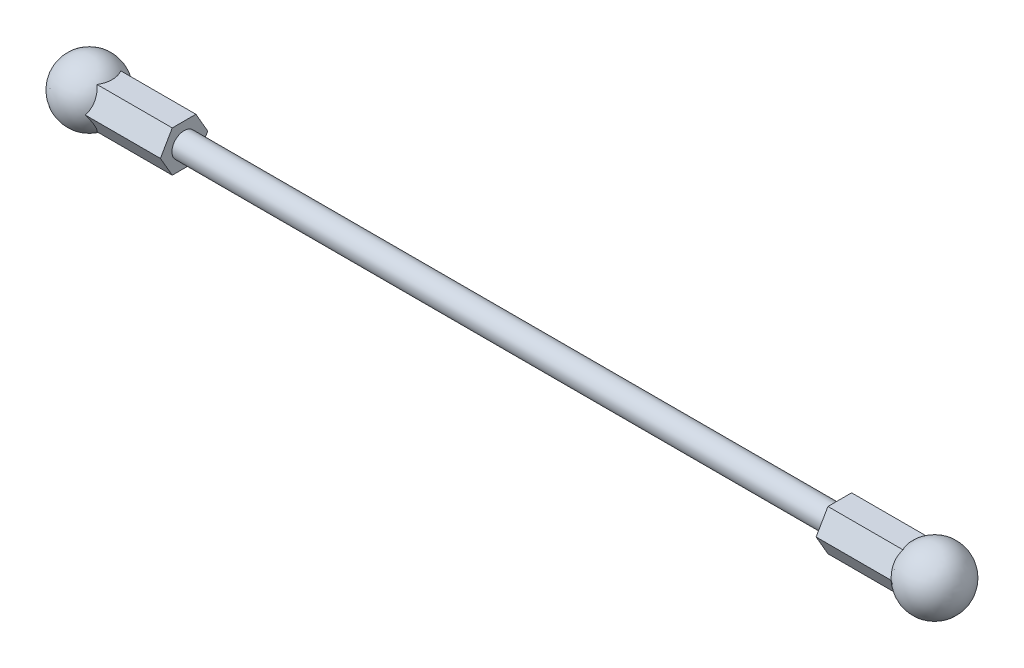
from build123d import *

# Parameters (mm, degrees)
BOSS_EXTRUDE2_DEPTH = 9.25
SKETCH5_R           = 1.190625
BOSS_EXTRUDE3_DEPTH = 64


with BuildPart() as part:
    # Sketch2 → Revolve1 (revolve)
    with BuildSketch(Plane.XY):
        with BuildLine():
            Line((0, 3), (0, -3))
            ThreePointArc((0, -3), (3, 0), (0, 3))
        make_face()
    revolve(axis=Axis((0, 3, 0), (0, -1, 0)))

    # Sketch3 → Boss-Extrude2 (add)
    with BuildSketch(Plane(origin=(0, 0, 0), x_dir=(0, 0, -1), z_dir=(1, 0, 0))):
        Polygon((1.154700538, -2), (2.309401077, 0), (1.154700538, 2), (-1.154700538, 2), (-2.309401077, 0), (-1.154700538, -2), align=None)
    boss_extrude2 = extrude(amount=BOSS_EXTRUDE2_DEPTH)

    # Sketch5 → Boss-Extrude3 (add)
    with BuildSketch(Plane(origin=(9.25, 0, 0), x_dir=(0, 0, -1), z_dir=(1, 0, 0))):
        with Locations(Location((0.007936131, 0, 0), (0, 0, 180))):
            Circle(SKETCH5_R)
    extrude(amount=BOSS_EXTRUDE3_DEPTH)


with BuildPart() as body_2:
    # Sketch7 → Revolve2 (revolve)
    with BuildSketch(Plane(origin=(82.5, 0, 0), x_dir=(0, 0, -1), z_dir=(1, 0, 0))):
        with BuildLine():
            ThreePointArc((0, 3), (3, 0), (0, -3))
            Line((0, -3), (0, 3))
        make_face()
    revolve(axis=Axis((82.5, 3, 0), (0, -1, 0)))

    # Mirror3: Boss-Extrude2 across plane
    add(boss_extrude2.mirror(Plane(origin=(41.25, 0, 0), x_dir=(0, 0, 1), z_dir=(1, 0, 0))))


solid = Compound([part.part, body_2.part])
